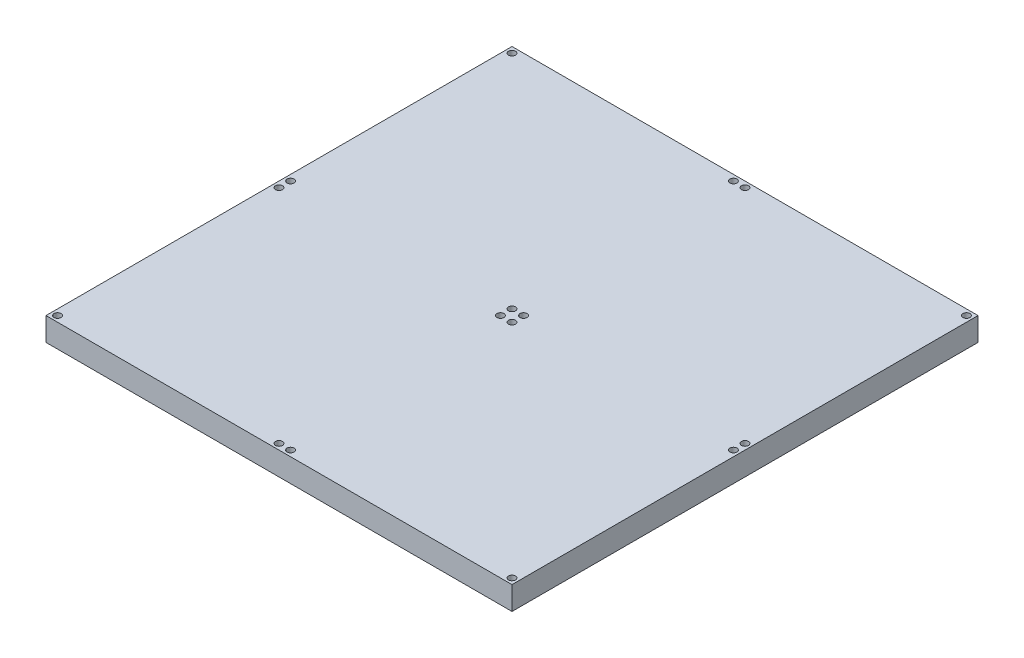
from build123d import *

# Parameters (mm, degrees)
SKETCH1_W            = 50.8
SKETCH1_H            = 50.8
BOSS_EXTRUDE1_DEPTH  = 5.08
SKETCH11_R           = 0.762
CUT_EXTRUDE6_DEPTH   = 2.54
LPATTERN1_COUNT      = 2
LPATTERN1_PITCH      = 50.8
LPATTERN1_COUNT_DIR2 = 2
LPATTERN1_PITCH_DIR2 = 50.8


with BuildPart() as part:
    # Sketch1 → Boss-Extrude1 (new body)
    with BuildSketch(Plane(origin=(0, 0, 0), x_dir=(1, 0, 0), z_dir=(0, 1, 0))):
        Rectangle(SKETCH1_W, SKETCH1_H)
    boss_extrude1 = extrude(amount=BOSS_EXTRUDE1_DEPTH)

    # Sketch11 → Cut-Extrude6 (cut)
    with BuildSketch(Plane(origin=(0, 5.08, 0), x_dir=(1, 0, 0), z_dir=(0, 1, 0))):
        with Locations(Location((-24.142764143, 24.142764143, 0), (0, 0, 270))):
            Circle(SKETCH11_R)
        with Locations(Location((24.142764143, 24.142764143, 0), (0, 0, 90))):
            Circle(SKETCH11_R)
        with Locations(Location((24.142764143, -24.142764143, 0), (0, 0, 270))):
            Circle(SKETCH11_R)
        with Locations(Location((-24.142764143, -24.142764143, 0), (0, 0, 90))):
            Circle(SKETCH11_R)
    cut_extrude6 = extrude(amount=-CUT_EXTRUDE6_DEPTH, mode=Mode.SUBTRACT)

    # LPattern1: Boss-Extrude1, Cut-Extrude6 2 × 2
    with Locations(*[(j * LPATTERN1_PITCH_DIR2, 0, i * LPATTERN1_PITCH) for i in range(LPATTERN1_COUNT) for j in range(LPATTERN1_COUNT_DIR2) if (i, j) != (0, 0)]):
        add(boss_extrude1)
        add(cut_extrude6, mode=Mode.SUBTRACT)


solid = part.part
